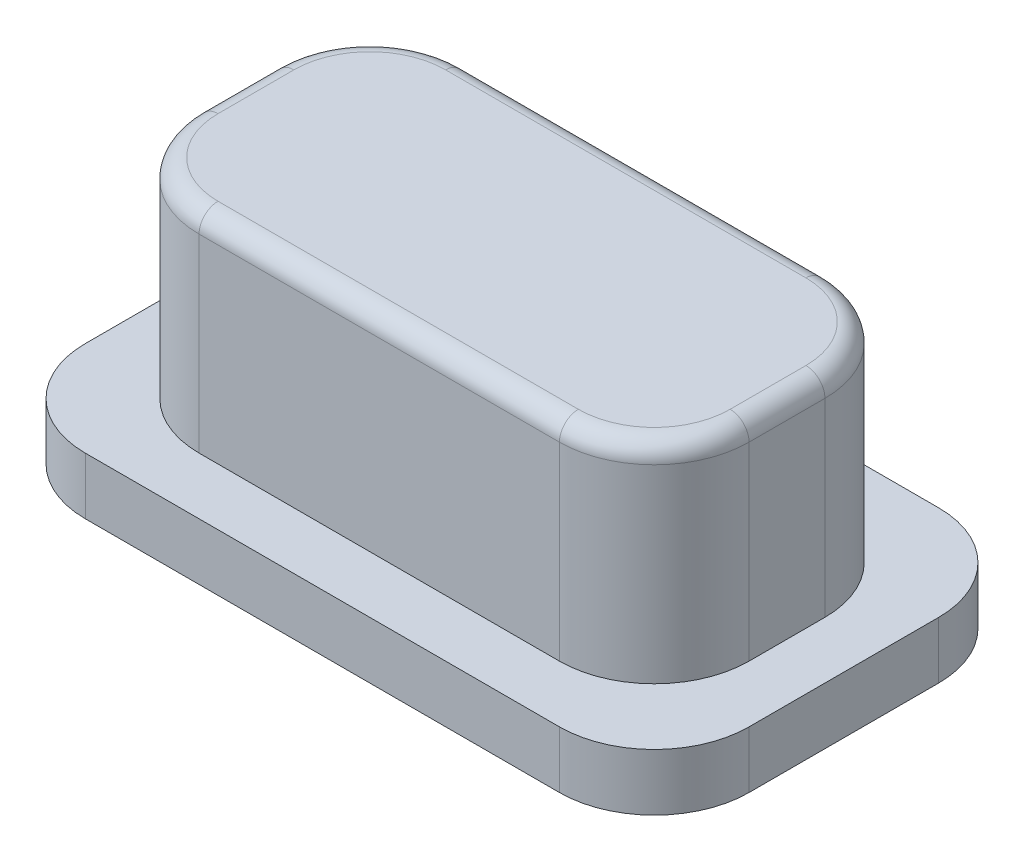
from build123d import *

# Parameters (mm, degrees)
SKETCH_1_W      = 7
SKETCH_1_H      = 4
EXTRUDE_1_DEPTH = 0.6
SKETCH_2_W      = 5.8
SKETCH_2_H      = 2.8
EXTRUDE_2_DEPTH = 2.2
FILLET_1_R      = 1
SKETCH_3_W      = 3
SKETCH_3_H      = 1.6
EXTRUDE_3_DEPTH = 0.1
FILLET_2_R      = 0.2


with BuildPart() as part:
    # 草图1 → 凸台-拉伸1 (new body)
    with BuildSketch(Plane(origin=(0, 0, 0), x_dir=(1, 0, 0), z_dir=(0, 1, 0))):
        with Locations((0.996893044, -0.239645207)):
            Rectangle(SKETCH_1_W, SKETCH_1_H)
    extrude(amount=EXTRUDE_1_DEPTH)

    # 草图2 → 凸台-拉伸2 (add)
    with BuildSketch(Plane(origin=(0, 0.6, 0), x_dir=(1, 0, 0), z_dir=(0, 1, 0))):
        with Locations((0.996893044, -0.239645207)):
            Rectangle(SKETCH_2_W, SKETCH_2_H)
    extrude(amount=EXTRUDE_2_DEPTH)

    # 圆角1
    fillet_1_edges = [part.edges().sort_by_distance(p)[0] for p in [
        (3.896893044, 1.7, 1.639645207),
        (3.896893044, 1.7, -1.160354793),
        (-1.903106956, 1.7, -1.160354793),
        (-1.903106956, 1.7, 1.639645207),
        (-2.503106956, 0.3, -1.760354793),
        (4.496893044, 0.3, -1.760354793),
        (4.496893044, 0.3, 2.239645207),
        (-2.503106956, 0.3, 2.239645207),
    ]]
    fillet(fillet_1_edges, radius=FILLET_1_R)

    # 草图3 → 凸台-拉伸3 (add)
    with BuildSketch(Plane(origin=(0, 0, 0), x_dir=(-1, 0, 0), z_dir=(0, -1, 0))):
        with Locations((-0.996893044, -0.239645207)):
            Rectangle(SKETCH_3_W, SKETCH_3_H)
    extrude(amount=EXTRUDE_3_DEPTH)

    # 圆角2
    fillet_2_edges = [part.edges().sort_by_distance(p)[0] for p in [
        (0.996893044, 2.8, -1.160354793),
        (3.896893044, 2.8, 0.239645207),
        (-1.903106956, 2.8, 0.239645207),
        (0.996893044, 2.8, 1.639645207),
        (3.603999825, 2.8, 1.346751988),
        (-1.610213737, 2.8, 1.346751988),
        (-1.610213737, 2.8, -0.867461574),
        (3.603999825, 2.8, -0.867461574),
    ]]
    fillet(fillet_2_edges, radius=FILLET_2_R)


solid = part.part
